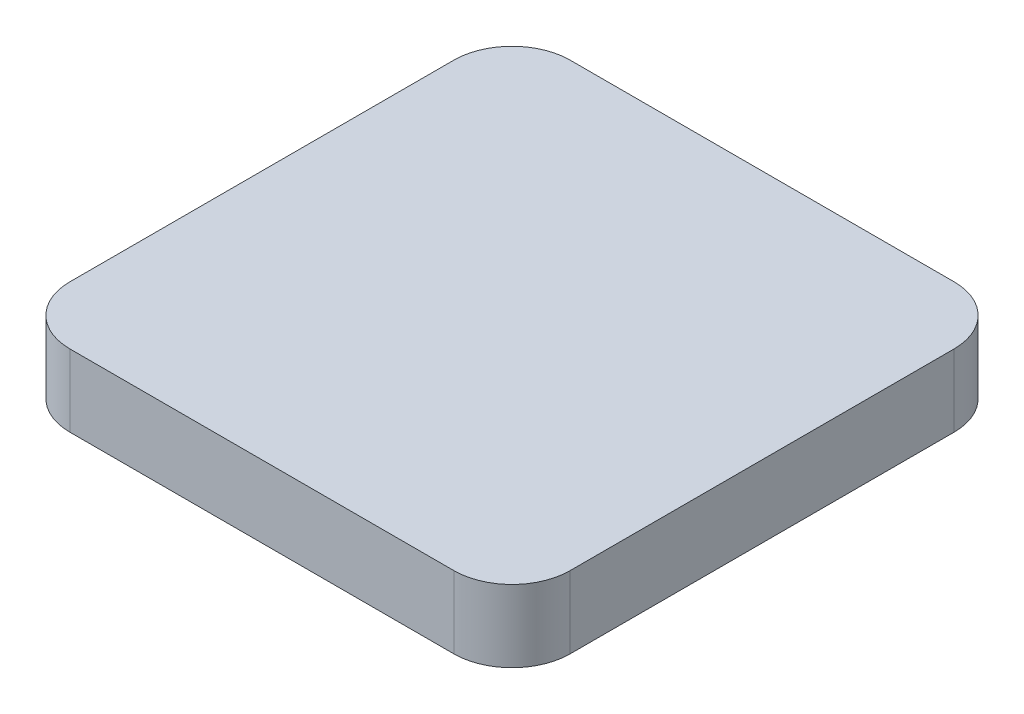
from build123d import *

# Parameters (mm, degrees)
BOSS_EXTRUDE1_DEPTH = 1.5748


with BuildPart() as part:
    # Sketch1 → Boss-Extrude1 (new body)
    with BuildSketch(Plane(origin=(0, 0, 0), x_dir=(1, 0, 0), z_dir=(0, 1, 0))):
        with BuildLine():
            Line((-4.191, 5.461), (4.191, 5.461))
            ThreePointArc((4.191, 5.461), (5.089025612, 5.089025612), (5.461, 4.191))
            Line((5.461, 4.191), (5.461, -4.191))
            ThreePointArc((5.461, -4.191), (5.089025612, -5.089025612), (4.191, -5.461))
            Line((4.191, -5.461), (-4.191, -5.461))
            ThreePointArc((-4.191, -5.461), (-5.089025612, -5.089025612), (-5.461, -4.191))
            Line((-5.461, -4.191), (-5.461, 4.191))
            ThreePointArc((-5.461, 4.191), (-5.089025612, 5.089025612), (-4.191, 5.461))
        make_face()
    extrude(amount=BOSS_EXTRUDE1_DEPTH)


solid = part.part
